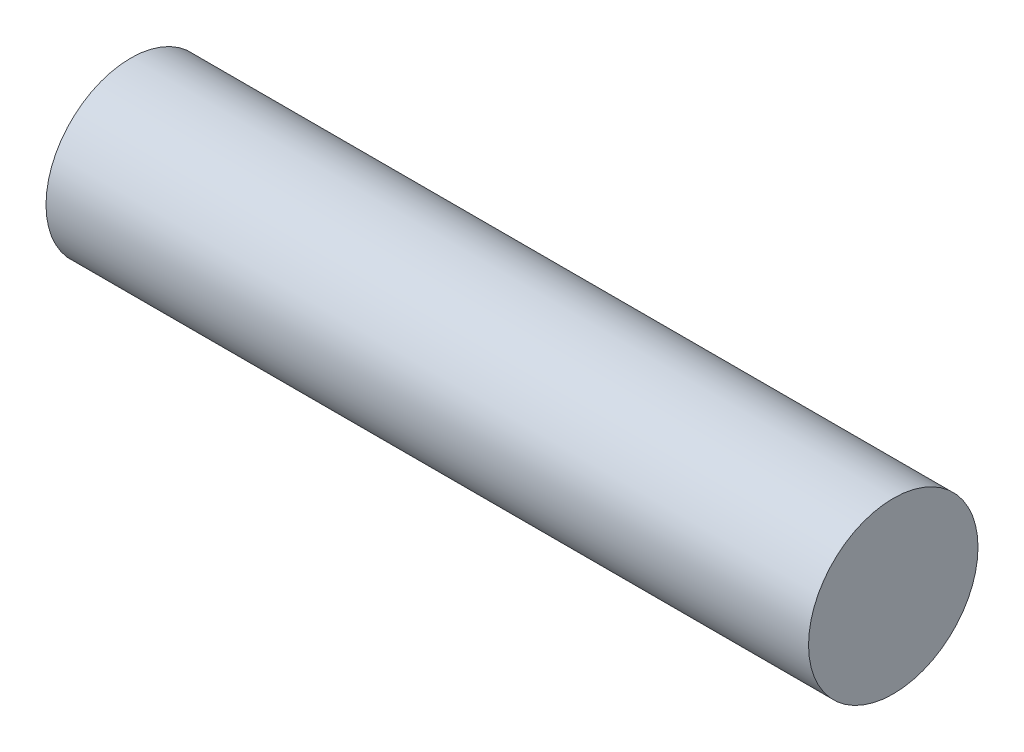
from build123d import *

# Parameters (mm, degrees)
SKETCH1_R           = 2.5
BOSS_EXTRUDE1_DEPTH = 22.5


with BuildPart() as part:
    # Sketch1 → Boss-Extrude1 (new body)
    with BuildSketch(Plane(origin=(0, 0, 0), x_dir=(0, 0, -1), z_dir=(1, 0, 0))):
        with Locations(Location((0, 0, 0), (0, 0, 180))):
            Circle(SKETCH1_R)
    extrude(amount=BOSS_EXTRUDE1_DEPTH)


solid = part.part
